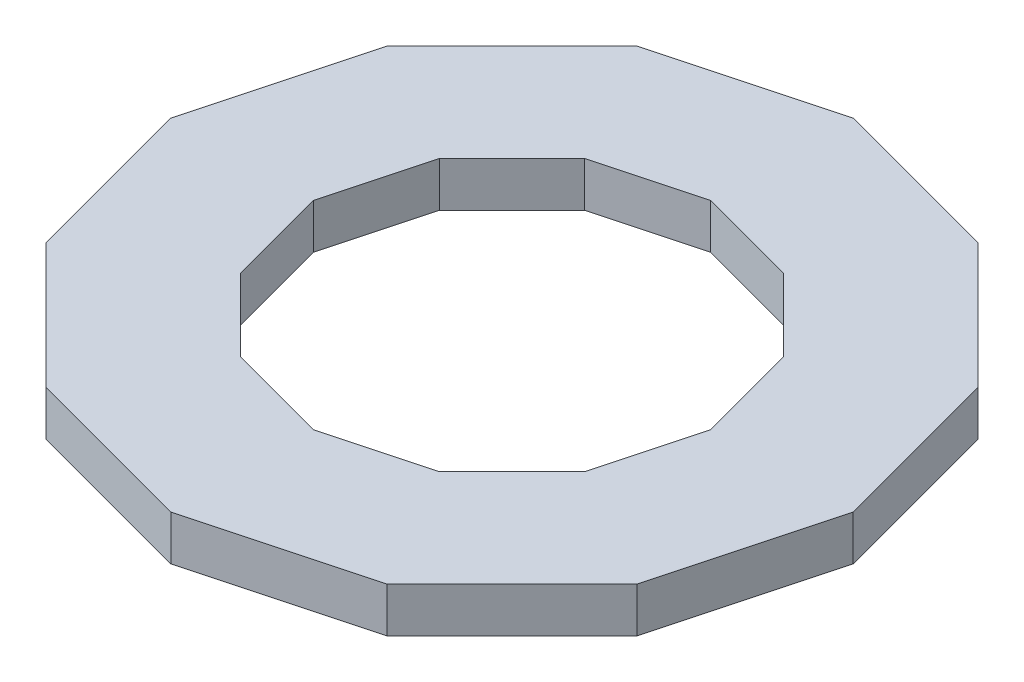
from build123d import *

# Parameters (mm, degrees)
BOSS_EXTRUDE2_DEPTH = 19.05


with BuildPart() as part:
    # Sketch2 → Boss-Extrude2 (new body)
    with BuildSketch(Plane(origin=(0, 0, 0), x_dir=(1, 0, 0), z_dir=(0, 1, 0))):
        Polygon((-144.753644328, 0), (-125.360333278, -72.376822164), (-72.376822164, -125.360333278), (0, -144.753644328), (72.376822164, -125.360333278), (125.360333278, -72.376822164), (144.753644328, 0), (125.360333278, 72.376822164), (72.376822164, 125.360333278), (0, 144.753644328), (-72.376822164, 125.360333278), (-125.360333278, 72.376822164), align=None)
        Polygon((-84.272809868, 0), (-72.982394194, -42.136404934), (-42.136404934, -72.982394194), (0, -84.272809868), (42.136404934, -72.982394194), (72.982394194, -42.136404934), (84.272809868, 0), (72.982394194, 42.136404934), (42.136404934, 72.982394194), (0, 84.272809868), (-42.136404934, 72.982394194), (-72.982394194, 42.136404934), align=None, mode=Mode.SUBTRACT)
    extrude(amount=BOSS_EXTRUDE2_DEPTH)


solid = part.part
